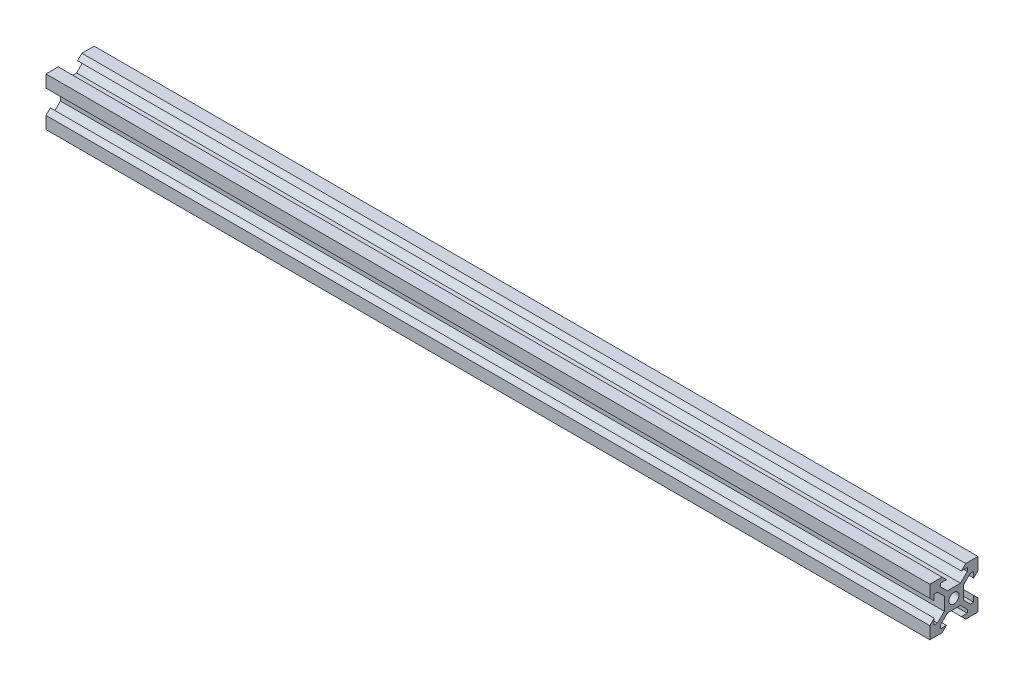
from build123d import *

# Parameters (mm, degrees)
SKETCH1_R           = 2.1
BOSS_EXTRUDE1_DEPTH = 367


with BuildPart() as part:
    # Sketch1 → Boss-Extrude1 (new body)
    with BuildSketch(Plane(origin=(0, 0, 0), x_dir=(0, 0, -1), z_dir=(1, 0, 0))):
        Polygon((6, 12.727207794), (6, 7.272792206), (3.171572875, 4.444365081), (1.8, 4.444365081), (1.8, 6.9), (0, 5.1), (0, 0), (5.1, 0), (6.9, 1.8), (4.444365081, 1.8), (4.444365081, 3.171572875), (7.272792206, 6), (12.727207794, 6), (15.555634919, 3.171572875), (15.555634919, 1.8), (13.1, 1.8), (14.9, 0), (20, 0), (20, 5.1), (18.2, 6.9), (18.2, 4.444365081), (16.828427125, 4.444365081), (14, 7.272792206), (14, 12.727207794), (16.828427125, 15.555634919), (18.2, 15.555634919), (18.2, 13.1), (20, 14.9), (20, 20), (14.9, 20), (13.1, 18.2), (15.555634919, 18.2), (15.555634919, 16.828427125), (12.727207794, 14), (7.272792206, 14), (4.444365081, 16.828427125), (4.444365081, 18.2), (6.9, 18.2), (5.1, 20), (0, 20), (0, 14.9), (1.8, 13.1), (1.8, 15.555634919), (3.171572875, 15.555634919), align=None)
        with Locations((10, 10)):
            Circle(SKETCH1_R, mode=Mode.SUBTRACT)
    extrude(amount=BOSS_EXTRUDE1_DEPTH)


solid = part.part
